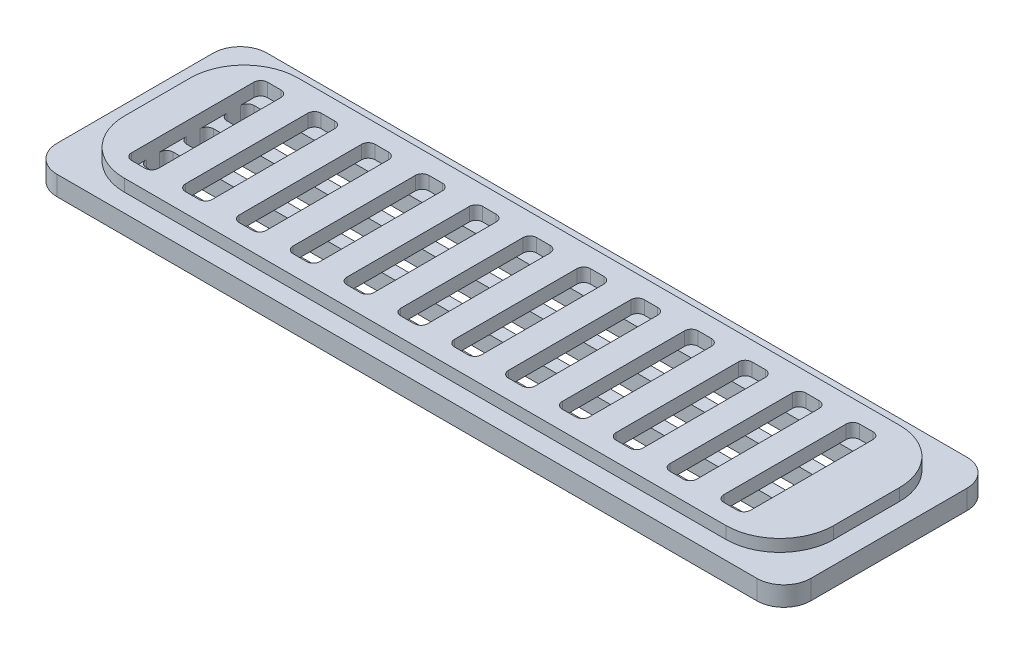
from build123d import *

# Parameters (mm, degrees)
BOSS_EXTRUDE1_DEPTH = 1.45
BOSS_EXTRUDE2_DEPTH = 0.9
CUT_EXTRUDE1_DEPTH  = 1
CUT_EXTRUDE2_REACH  = 31.097


with BuildPart() as part:
    # Sketch1 → Boss-Extrude1 (new body)
    with BuildSketch(Plane(origin=(0, 0, 0), x_dir=(1, 0, 0), z_dir=(0, 1, 0))):
        with BuildLine():
            Line((-26, -7.8), (26, -7.8))
            ThreePointArc((26, -7.8), (27.414213562, -7.214213562), (28, -5.8))
            Line((28, -5.8), (28, 5.8))
            ThreePointArc((28, 5.8), (27.414213562, 7.214213562), (26, 7.8))
            Line((26, 7.8), (-26, 7.8))
            ThreePointArc((-26, 7.8), (-27.414213562, 7.214213562), (-28, 5.8))
            Line((-28, 5.8), (-28, -5.8))
            ThreePointArc((-28, -5.8), (-27.414213562, -7.214213562), (-26, -7.8))
        make_face()
    extrude(amount=BOSS_EXTRUDE1_DEPTH)

    # Sketch2 → Boss-Extrude2 (add)
    with BuildSketch(Plane(origin=(0, 1.45, 0), x_dir=(1, 0, 0), z_dir=(0, 1, 0))):
        with BuildLine():
            Line((-22.35, -6.45), (22.35, -6.45))
            ThreePointArc((22.35, -6.45), (25.178427125, -5.278427125), (26.35, -2.45))
            Line((26.35, -2.45), (26.35, 2.45))
            ThreePointArc((26.35, 2.45), (25.178427125, 5.278427125), (22.35, 6.45))
            Line((22.35, 6.45), (-22.35, 6.45))
            ThreePointArc((-22.35, 6.45), (-25.178427125, 5.278427125), (-26.35, 2.45))
            Line((-26.35, 2.45), (-26.35, -2.45))
            ThreePointArc((-26.35, -2.45), (-25.178427125, -5.278427125), (-22.35, -6.45))
        make_face()
    extrude(amount=BOSS_EXTRUDE2_DEPTH)

    # Sketch3 → Cut-Extrude1 (cut)
    with BuildSketch(Plane(origin=(0, 2.35, 0), x_dir=(1, 0, 0), z_dir=(0, 1, 0))):
        with BuildLine():
            Line((-23.219931233, 5.046139044), (-22.219931233, 5.046139044))
            ThreePointArc((-22.219931233, 5.046139044), (-21.866377842, 4.899692435), (-21.719931233, 4.546139044))
            Line((-21.719931233, 4.546139044), (-21.719931233, -4.546139044))
            ThreePointArc((-21.719931233, -4.546139044), (-21.866377842, -4.899692435), (-22.219931233, -5.046139044))
            Line((-22.219931233, -5.046139044), (-23.219931233, -5.046139044))
            ThreePointArc((-23.219931233, -5.046139044), (-23.573484623, -4.899692435), (-23.719931233, -4.546139044))
            Line((-23.719931233, -4.546139044), (-23.719931233, 4.546139044))
            ThreePointArc((-23.719931233, 4.546139044), (-23.573484623, 4.899692435), (-23.219931233, 5.046139044))
        make_face()
        with BuildLine():
            Line((-19.219931233, 5.046139044), (-18.219931233, 5.046139044))
            ThreePointArc((-18.219931233, 5.046139044), (-17.866377842, 4.899692435), (-17.719931233, 4.546139044))
            Line((-17.719931233, 4.546139044), (-17.719931233, -4.546139044))
            ThreePointArc((-17.719931233, -4.546139044), (-17.866377842, -4.899692435), (-18.219931233, -5.046139044))
            Line((-18.219931233, -5.046139044), (-19.219931233, -5.046139044))
            ThreePointArc((-19.219931233, -5.046139044), (-19.573484623, -4.899692435), (-19.719931233, -4.546139044))
            Line((-19.719931233, -4.546139044), (-19.719931233, 4.546139044))
            ThreePointArc((-19.719931233, 4.546139044), (-19.573484623, 4.899692435), (-19.219931233, 5.046139044))
        make_face()
        with BuildLine():
            Line((-15.219931233, 5.046139044), (-14.219931233, 5.046139044))
            ThreePointArc((-14.219931233, 5.046139044), (-13.866377842, 4.899692435), (-13.719931233, 4.546139044))
            Line((-13.719931233, 4.546139044), (-13.719931233, -4.546139044))
            ThreePointArc((-13.719931233, -4.546139044), (-13.866377842, -4.899692435), (-14.219931233, -5.046139044))
            Line((-14.219931233, -5.046139044), (-15.219931233, -5.046139044))
            ThreePointArc((-15.219931233, -5.046139044), (-15.573484623, -4.899692435), (-15.719931233, -4.546139044))
            Line((-15.719931233, -4.546139044), (-15.719931233, 4.546139044))
            ThreePointArc((-15.719931233, 4.546139044), (-15.573484623, 4.899692435), (-15.219931233, 5.046139044))
        make_face()
        with BuildLine():
            Line((-11.219931233, 5.046139044), (-10.219931233, 5.046139044))
            ThreePointArc((-10.219931233, 5.046139044), (-9.866377842, 4.899692435), (-9.719931233, 4.546139044))
            Line((-9.719931233, 4.546139044), (-9.719931233, -4.546139044))
            ThreePointArc((-9.719931233, -4.546139044), (-9.866377842, -4.899692435), (-10.219931233, -5.046139044))
            Line((-10.219931233, -5.046139044), (-11.219931233, -5.046139044))
            ThreePointArc((-11.219931233, -5.046139044), (-11.573484623, -4.899692435), (-11.719931233, -4.546139044))
            Line((-11.719931233, -4.546139044), (-11.719931233, 4.546139044))
            ThreePointArc((-11.719931233, 4.546139044), (-11.573484623, 4.899692435), (-11.219931233, 5.046139044))
        make_face()
        with BuildLine():
            Line((-7.219931233, 5.046139044), (-6.219931233, 5.046139044))
            ThreePointArc((-6.219931233, 5.046139044), (-5.866377842, 4.899692435), (-5.719931233, 4.546139044))
            Line((-5.719931233, 4.546139044), (-5.719931233, -4.546139044))
            ThreePointArc((-5.719931233, -4.546139044), (-5.866377842, -4.899692435), (-6.219931233, -5.046139044))
            Line((-6.219931233, -5.046139044), (-7.219931233, -5.046139044))
            ThreePointArc((-7.219931233, -5.046139044), (-7.573484623, -4.899692435), (-7.719931233, -4.546139044))
            Line((-7.719931233, -4.546139044), (-7.719931233, 4.546139044))
            ThreePointArc((-7.719931233, 4.546139044), (-7.573484623, 4.899692435), (-7.219931233, 5.046139044))
        make_face()
        with BuildLine():
            Line((-3.219931233, 5.046139044), (-2.219931233, 5.046139044))
            ThreePointArc((-2.219931233, 5.046139044), (-1.866377842, 4.899692435), (-1.719931233, 4.546139044))
            Line((-1.719931233, 4.546139044), (-1.719931233, -4.546139044))
            ThreePointArc((-1.719931233, -4.546139044), (-1.866377842, -4.899692435), (-2.219931233, -5.046139044))
            Line((-2.219931233, -5.046139044), (-3.219931233, -5.046139044))
            ThreePointArc((-3.219931233, -5.046139044), (-3.573484623, -4.899692435), (-3.719931233, -4.546139044))
            Line((-3.719931233, -4.546139044), (-3.719931233, 4.546139044))
            ThreePointArc((-3.719931233, 4.546139044), (-3.573484623, 4.899692435), (-3.219931233, 5.046139044))
        make_face()
        with BuildLine():
            Line((0.780068767, 5.046139044), (1.780068767, 5.046139044))
            ThreePointArc((1.780068767, 5.046139044), (2.133622158, 4.899692435), (2.280068767, 4.546139044))
            Line((2.280068767, 4.546139044), (2.280068767, -4.546139044))
            ThreePointArc((2.280068767, -4.546139044), (2.133622158, -4.899692435), (1.780068767, -5.046139044))
            Line((1.780068767, -5.046139044), (0.780068767, -5.046139044))
            ThreePointArc((0.780068767, -5.046139044), (0.426515377, -4.899692435), (0.280068767, -4.546139044))
            Line((0.280068767, -4.546139044), (0.280068767, 4.546139044))
            ThreePointArc((0.280068767, 4.546139044), (0.426515377, 4.899692435), (0.780068767, 5.046139044))
        make_face()
        with BuildLine():
            Line((4.780068767, 5.046139044), (5.780068767, 5.046139044))
            ThreePointArc((5.780068767, 5.046139044), (6.133622158, 4.899692435), (6.280068767, 4.546139044))
            Line((6.280068767, 4.546139044), (6.280068767, -4.546139044))
            ThreePointArc((6.280068767, -4.546139044), (6.133622158, -4.899692435), (5.780068767, -5.046139044))
            Line((5.780068767, -5.046139044), (4.780068767, -5.046139044))
            ThreePointArc((4.780068767, -5.046139044), (4.426515377, -4.899692435), (4.280068767, -4.546139044))
            Line((4.280068767, -4.546139044), (4.280068767, 4.546139044))
            ThreePointArc((4.280068767, 4.546139044), (4.426515377, 4.899692435), (4.780068767, 5.046139044))
        make_face()
        with BuildLine():
            Line((8.780068767, 5.046139044), (9.780068767, 5.046139044))
            ThreePointArc((9.780068767, 5.046139044), (10.133622158, 4.899692435), (10.280068767, 4.546139044))
            Line((10.280068767, 4.546139044), (10.280068767, -4.546139044))
            ThreePointArc((10.280068767, -4.546139044), (10.133622158, -4.899692435), (9.780068767, -5.046139044))
            Line((9.780068767, -5.046139044), (8.780068767, -5.046139044))
            ThreePointArc((8.780068767, -5.046139044), (8.426515377, -4.899692435), (8.280068767, -4.546139044))
            Line((8.280068767, -4.546139044), (8.280068767, 4.546139044))
            ThreePointArc((8.280068767, 4.546139044), (8.426515377, 4.899692435), (8.780068767, 5.046139044))
        make_face()
        with BuildLine():
            Line((12.780068767, 5.046139044), (13.780068767, 5.046139044))
            ThreePointArc((13.780068767, 5.046139044), (14.133622158, 4.899692435), (14.280068767, 4.546139044))
            Line((14.280068767, 4.546139044), (14.280068767, -4.546139044))
            ThreePointArc((14.280068767, -4.546139044), (14.133622158, -4.899692435), (13.780068767, -5.046139044))
            Line((13.780068767, -5.046139044), (12.780068767, -5.046139044))
            ThreePointArc((12.780068767, -5.046139044), (12.426515377, -4.899692435), (12.280068767, -4.546139044))
            Line((12.280068767, -4.546139044), (12.280068767, 4.546139044))
            ThreePointArc((12.280068767, 4.546139044), (12.426515377, 4.899692435), (12.780068767, 5.046139044))
        make_face()
        with BuildLine():
            Line((16.780068767, 5.046139044), (17.780068767, 5.046139044))
            ThreePointArc((17.780068767, 5.046139044), (18.133622158, 4.899692435), (18.280068767, 4.546139044))
            Line((18.280068767, 4.546139044), (18.280068767, -4.546139044))
            ThreePointArc((18.280068767, -4.546139044), (18.133622158, -4.899692435), (17.780068767, -5.046139044))
            Line((17.780068767, -5.046139044), (16.780068767, -5.046139044))
            ThreePointArc((16.780068767, -5.046139044), (16.426515377, -4.899692435), (16.280068767, -4.546139044))
            Line((16.280068767, -4.546139044), (16.280068767, 4.546139044))
            ThreePointArc((16.280068767, 4.546139044), (16.426515377, 4.899692435), (16.780068767, 5.046139044))
        make_face()
        with BuildLine():
            Line((20.780068767, 5.046139044), (21.780068767, 5.046139044))
            ThreePointArc((21.780068767, 5.046139044), (22.133622158, 4.899692435), (22.280068767, 4.546139044))
            Line((22.280068767, 4.546139044), (22.280068767, -4.546139044))
            ThreePointArc((22.280068767, -4.546139044), (22.133622158, -4.899692435), (21.780068767, -5.046139044))
            Line((21.780068767, -5.046139044), (20.780068767, -5.046139044))
            ThreePointArc((20.780068767, -5.046139044), (20.426515377, -4.899692435), (20.280068767, -4.546139044))
            Line((20.280068767, -4.546139044), (20.280068767, 4.546139044))
            ThreePointArc((20.280068767, 4.546139044), (20.426515377, 4.899692435), (20.780068767, 5.046139044))
        make_face()
    extrude(amount=-CUT_EXTRUDE1_DEPTH, mode=Mode.SUBTRACT)

    # Sketch4 → Cut-Extrude2 (cut, up to next)
    with BuildSketch(Plane(origin=(0, 1.35, 0), x_dir=(1, 0, 0), z_dir=(0, 1, 0)), mode=Mode.PRIVATE) as cut_extrude2_sk1:
        with BuildLine():
            Line((-23.219931233, 4.046139044), (21.780068767, 4.046139044))
            ThreePointArc((21.780068767, 4.046139044), (22.133622158, 3.899692435), (22.280068767, 3.546139044))
            Line((22.280068767, 3.546139044), (22.280068767, 2.546139044))
            ThreePointArc((22.280068767, 2.546139044), (22.133622158, 2.192585654), (21.780068767, 2.046139044))
            Line((21.780068767, 2.046139044), (-23.219931233, 2.046139044))
            ThreePointArc((-23.219931233, 2.046139044), (-23.573484623, 2.192585654), (-23.719931233, 2.546139044))
            Line((-23.719931233, 2.546139044), (-23.719931233, 3.546139044))
            ThreePointArc((-23.719931233, 3.546139044), (-23.573484623, 3.899692435), (-23.219931233, 4.046139044))
        make_face()
    cut_extrude2_tool1 = extrude(cut_extrude2_sk1.sketch, amount=-CUT_EXTRUDE2_REACH, mode=Mode.PRIVATE) & part.part
    # Sketch4 → Cut-Extrude2 (cut, up to next)
    with BuildSketch(Plane(origin=(0, 1.35, 0), x_dir=(1, 0, 0), z_dir=(0, 1, 0)), mode=Mode.PRIVATE) as cut_extrude2_sk2:
        with BuildLine():
            Line((-23.219931233, 1.046139044), (21.780068767, 1.046139044))
            ThreePointArc((21.780068767, 1.046139044), (22.133622158, 0.899692435), (22.280068767, 0.546139044))
            Line((22.280068767, 0.546139044), (22.280068767, -0.453860956))
            ThreePointArc((22.280068767, -0.453860956), (22.133622158, -0.807414346), (21.780068767, -0.953860956))
            Line((21.780068767, -0.953860956), (-23.219931233, -0.953860956))
            ThreePointArc((-23.219931233, -0.953860956), (-23.573484623, -0.807414346), (-23.719931233, -0.453860956))
            Line((-23.719931233, -0.453860956), (-23.719931233, 0.546139044))
            ThreePointArc((-23.719931233, 0.546139044), (-23.573484623, 0.899692435), (-23.219931233, 1.046139044))
        make_face()
    cut_extrude2_tool2 = extrude(cut_extrude2_sk2.sketch, amount=-CUT_EXTRUDE2_REACH, mode=Mode.PRIVATE) & part.part
    # Sketch4 → Cut-Extrude2 (cut, up to next)
    with BuildSketch(Plane(origin=(0, 1.35, 0), x_dir=(1, 0, 0), z_dir=(0, 1, 0)), mode=Mode.PRIVATE) as cut_extrude2_sk3:
        with BuildLine():
            Line((-23.219931233, -1.953860956), (21.780068767, -1.953860956))
            ThreePointArc((21.780068767, -1.953860956), (22.133622158, -2.100307565), (22.280068767, -2.453860956))
            Line((22.280068767, -2.453860956), (22.280068767, -3.453860956))
            ThreePointArc((22.280068767, -3.453860956), (22.133622158, -3.807414346), (21.780068767, -3.953860956))
            Line((21.780068767, -3.953860956), (-23.219931233, -3.953860956))
            ThreePointArc((-23.219931233, -3.953860956), (-23.573484623, -3.807414346), (-23.719931233, -3.453860956))
            Line((-23.719931233, -3.453860956), (-23.719931233, -2.453860956))
            ThreePointArc((-23.719931233, -2.453860956), (-23.573484623, -2.100307565), (-23.219931233, -1.953860956))
        make_face()
    cut_extrude2_tool3 = extrude(cut_extrude2_sk3.sketch, amount=-CUT_EXTRUDE2_REACH, mode=Mode.PRIVATE) & part.part
    add(cut_extrude2_tool1.solids().sort_by_distance((-0.719931, 1.35, -3.046139))[0], mode=Mode.SUBTRACT)
    add(cut_extrude2_tool2.solids().sort_by_distance((-0.719931, 1.35, -0.046139))[0], mode=Mode.SUBTRACT)
    add(cut_extrude2_tool3.solids().sort_by_distance((-0.719931, 1.35, 2.953861))[0], mode=Mode.SUBTRACT)


solid = part.part
